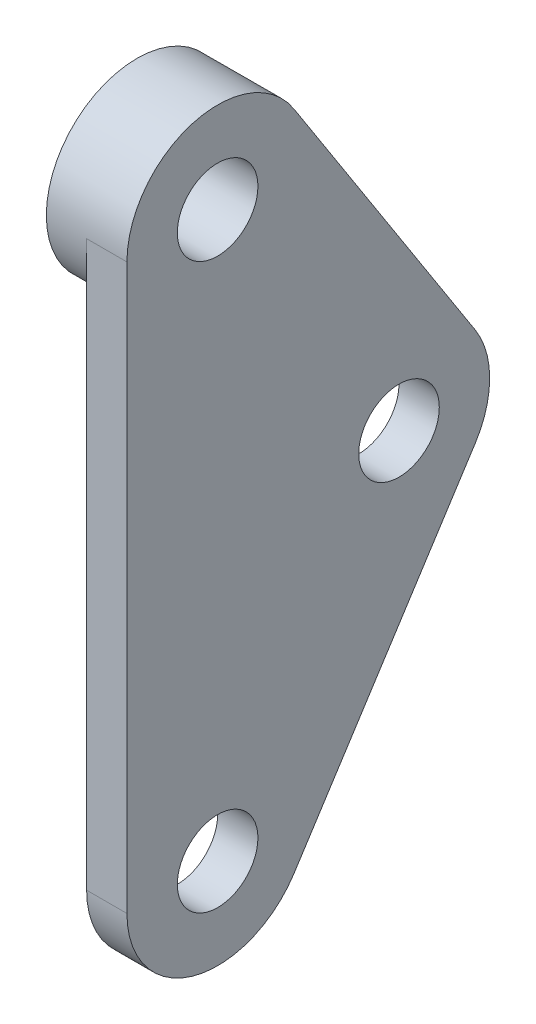
from build123d import *

# Parameters (mm, degrees)
EXTRUDE_1_DEPTH          = 2
EXTRUDE_START            = -2
SKETCH_1_4_R             = 4.5
EXTRUDE_2_DEPTH          = 2
CUT_EXTRUDE_1_DEPTH      = 42.194659848
CUT_EXTRUDE_1_DEPTH_BACK = 42.194659848
SKETCH_1_3_R             = 2


with BuildPart() as part:
    # 草图1 → 凸台-拉伸1 (new body)
    with BuildSketch(Plane(origin=(0, 0, 0), x_dir=(0, 0, -1), z_dir=(1, 0, 0))):
        with BuildLine():
            Line((17.285303139, -16.066590839), (8.285303139, -2.066590839))
            ThreePointArc((8.285303139, -2.066590839), (3.231903814, -0.182369624), (0, -4.5))
            Line((0, -4.5), (0, -32.499999989))
            ThreePointArc((0, -32.499999989), (3.231903809, -36.817630374), (8.285303139, -34.933409161))
            Line((8.285303139, -34.933409161), (17.285303139, -20.933409161))
            ThreePointArc((17.285303139, -20.933409161), (18, -18.5), (17.285303139, -16.066590839))
        make_face()
    extrude(amount=EXTRUDE_1_DEPTH)

    # 草图1<4> → 凸台-拉伸2 (add)
    with BuildSketch(Plane(origin=(0, 0, 0), x_dir=(0, 0, -1), z_dir=(1, 0, 0)).offset(EXTRUDE_START)):
        with Locations((4.5, -4.5)):
            Circle(SKETCH_1_4_R)
    extrude(amount=EXTRUDE_2_DEPTH)

    # 草图1<3> → 切除-拉伸1 (cut, two sides: drawn at the far end of the back side and taken through both)
    with BuildSketch(Plane(origin=(0, 0, 0), x_dir=(0, 0, -1), z_dir=(1, 0, 0)).offset(-CUT_EXTRUDE_1_DEPTH_BACK)):
        with Locations((4.5, -4.5)):
            Circle(SKETCH_1_3_R)
        with Locations((13.5, -18.5)):
            Circle(SKETCH_1_3_R)
        with Locations((4.5, -32.5)):
            Circle(SKETCH_1_3_R)
    extrude(amount=CUT_EXTRUDE_1_DEPTH + CUT_EXTRUDE_1_DEPTH_BACK, mode=Mode.SUBTRACT)


solid = part.part
